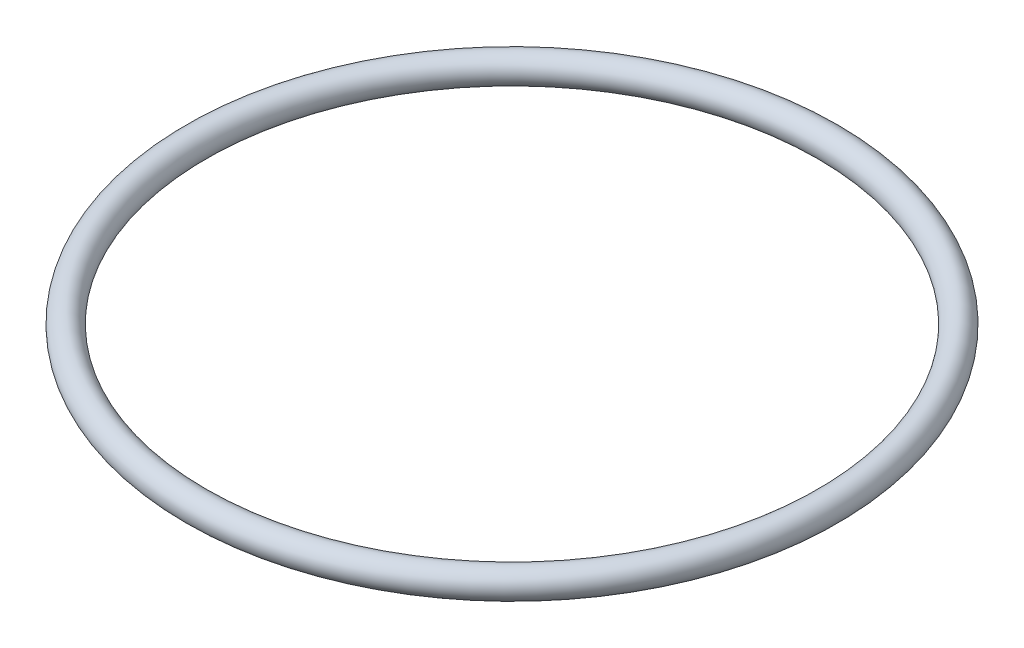
from build123d import *

# Parameters (mm, degrees)
CROQUIS2_R = 1.31


with BuildPart() as part:
    # Croquis2 → Revolución1 (revolve)
    with BuildSketch(Plane(origin=(0, 0, 0), x_dir=(0, 0, -1), z_dir=(1, 0, 0))):
        Circle(CROQUIS2_R)
    revolve(axis=Axis((0, 5.119884785, 29.72), (0, -1, 0)))


solid = part.part
